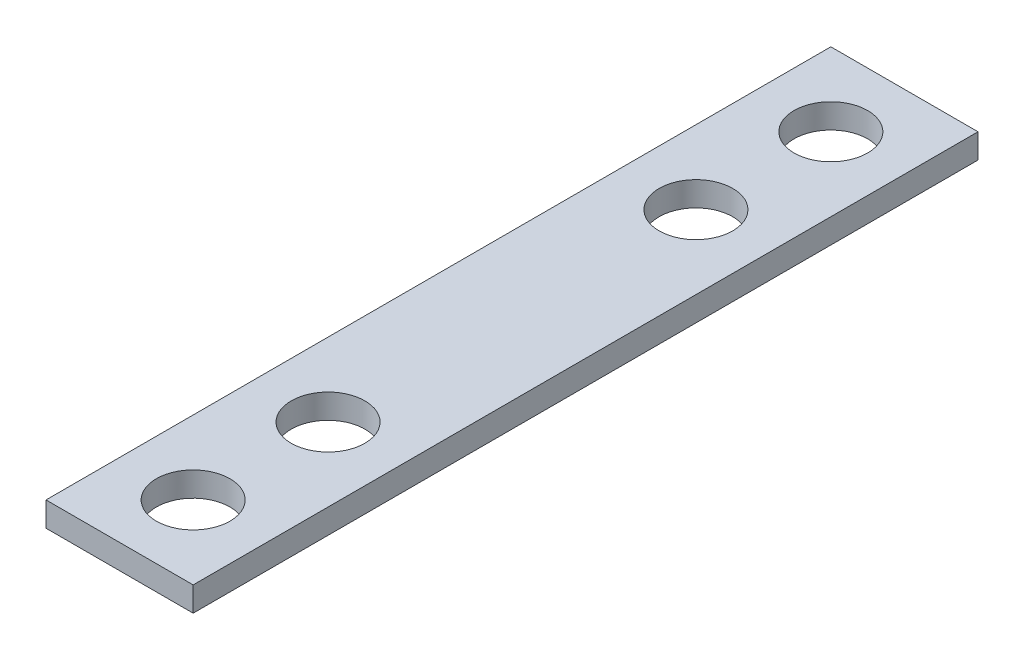
from build123d import *

# Parameters (mm, degrees)
SKETCH_1_R          = 35
SKETCH_1_R_2        = 1.5
EXTRUDE_1_DEPTH     = 1
SKETCH_2_W          = 6
SKETCH_2_H          = 32
SKETCH_2_R          = 1.5
EXTRUDE_2_DEPTH     = 1
SKETCH_3_R          = 35
CUT_EXTRUDE_1_DEPTH = 1


with BuildPart() as part:
    # Эскиз1 → Бобышка-Вытянуть1 (new body)
    with BuildSketch(Plane(origin=(0, 0, 0), x_dir=(1, 0, 0), z_dir=(0, 1, 0))):
        with Locations(Location((0, 0, 0), (0, 0, 270))):
            Circle(SKETCH_1_R)
        with BuildLine():
            Line((-20.493901532, -16), (20.493901532, -16))
            ThreePointArc((20.493901532, -16), (0, -26), (-20.493901532, -16))
        make_face(mode=Mode.SUBTRACT)
        with BuildLine():
            Line((-18, -10), (-24, -10))
            ThreePointArc((-24, -10), (-26, 0), (-24, 10))
            Line((-24, 10), (-18, 10))
            Line((-18, 10), (24, 10))
            ThreePointArc((24, 10), (26, 0), (24, -10))
            Line((24, -10), (-18, -10))
        make_face(mode=Mode.SUBTRACT)
        with Locations(Location((-18, -13, 0), (0, 0, 270))):
            Circle(SKETCH_1_R_2, mode=Mode.SUBTRACT)
        with Locations(Location((-9, -13, 0), (0, 0, 270))):
            Circle(SKETCH_1_R_2, mode=Mode.SUBTRACT)
        with Locations(Location((0, -13, 0), (0, 0, 270))):
            Circle(SKETCH_1_R_2, mode=Mode.SUBTRACT)
        with Locations(Location((9, -13, 0), (0, 0, 270))):
            Circle(SKETCH_1_R_2, mode=Mode.SUBTRACT)
        with Locations(Location((18, -13, 0), (0, 0, 270))):
            Circle(SKETCH_1_R_2, mode=Mode.SUBTRACT)
        with Locations(Location((-21.566756826, -21.566756826, 0), (0, 0, 270))):
            Circle(SKETCH_1_R_2, mode=Mode.SUBTRACT)
        with Locations(Location((-30.5, 0, 0), (0, 0, 270))):
            Circle(SKETCH_1_R_2, mode=Mode.SUBTRACT)
        with Locations(Location((0, -30.5, 0), (0, 0, 270))):
            Circle(SKETCH_1_R_2, mode=Mode.SUBTRACT)
        with Locations(Location((21.566756826, -21.566756826, 0), (0, 0, 270))):
            Circle(SKETCH_1_R_2, mode=Mode.SUBTRACT)
        with Locations(Location((-21.566756826, 21.566756826, 0), (0, 0, 270))):
            Circle(SKETCH_1_R_2, mode=Mode.SUBTRACT)
        with BuildLine():
            ThreePointArc((-20.493901532, 16), (0, 26), (20.493901532, 16))
            Line((20.493901532, 16), (-20.493901532, 16))
        make_face(mode=Mode.SUBTRACT)
        with Locations(Location((0, 30.5, 0), (0, 0, 270))):
            Circle(SKETCH_1_R_2, mode=Mode.SUBTRACT)
        with Locations(Location((21.566756826, 21.566756826, 0), (0, 0, 270))):
            Circle(SKETCH_1_R_2, mode=Mode.SUBTRACT)
        with Locations(Location((30.5, 0, 0), (0, 0, 270))):
            Circle(SKETCH_1_R_2, mode=Mode.SUBTRACT)
        with Locations(Location((18, 13, 0), (0, 0, 270))):
            Circle(SKETCH_1_R_2, mode=Mode.SUBTRACT)
        with Locations(Location((-18, 13, 0), (0, 0, 270))):
            Circle(SKETCH_1_R_2, mode=Mode.SUBTRACT)
        with Locations(Location((-9, 13, 0), (0, 0, 270))):
            Circle(SKETCH_1_R_2, mode=Mode.SUBTRACT)
        with Locations(Location((0, 13, 0), (0, 0, 270))):
            Circle(SKETCH_1_R_2, mode=Mode.SUBTRACT)
        with Locations(Location((9, 13, 0), (0, 0, 270))):
            Circle(SKETCH_1_R_2, mode=Mode.SUBTRACT)
    extrude(amount=EXTRUDE_1_DEPTH)

    # Эскиз2 → Бобышка-Вытянуть2 (add)
    with BuildSketch(Plane(origin=(0, 1, 0), x_dir=(1, 0, 0), z_dir=(0, 1, 0))):
        with Locations((-9, 0)):
            Rectangle(SKETCH_2_W, SKETCH_2_H)
        with Locations(Location((-9, -7.5, 0), (0, 0, 270))):
            Circle(SKETCH_2_R, mode=Mode.SUBTRACT)
        with Locations(Location((-9, 7.5, 0), (0, 0, 270))):
            Circle(SKETCH_2_R, mode=Mode.SUBTRACT)
        with Locations(Location((-9, -13, 0), (0, 0, 270))):
            Circle(SKETCH_2_R, mode=Mode.SUBTRACT)
        with Locations(Location((-9, 13, 0), (0, 0, 270))):
            Circle(SKETCH_2_R, mode=Mode.SUBTRACT)
    extrude(amount=EXTRUDE_2_DEPTH)

    # Эскиз3 → Вырез-Вытянуть1 (cut)
    with BuildSketch(Plane.XZ):
        Circle(SKETCH_3_R)
    extrude(amount=-CUT_EXTRUDE_1_DEPTH, mode=Mode.SUBTRACT)


solid = part.part
